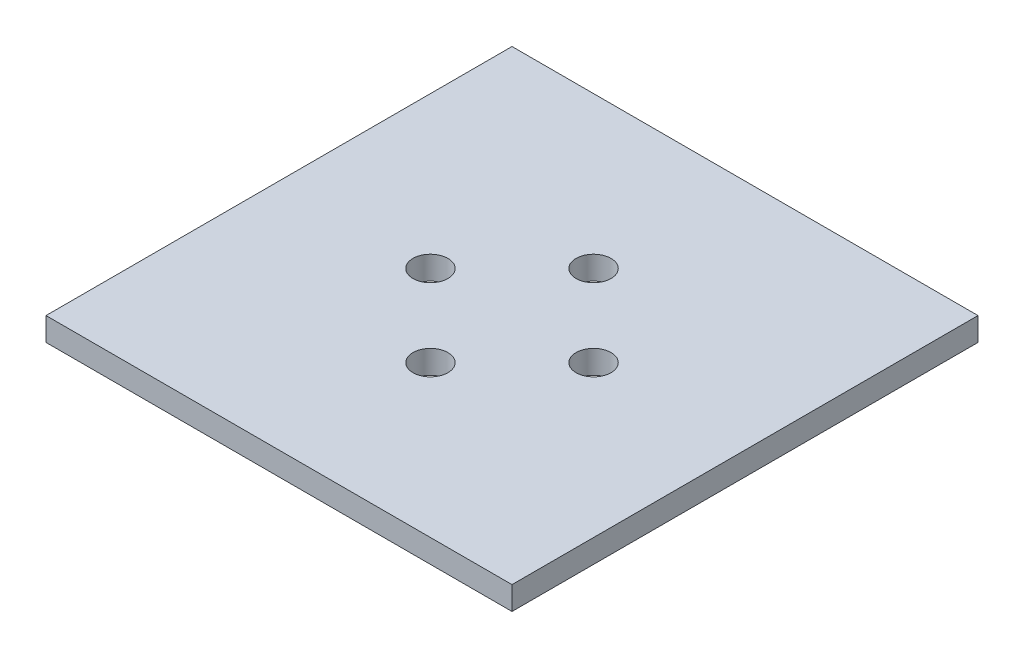
from build123d import *

# Parameters (mm, degrees)
SKETCH_1_W      = 40
SKETCH_1_H      = 40
SKETCH_1_R      = 1.5
EXTRUDE_1_DEPTH = 2


with BuildPart() as part:
    # Эскиз1 → Бобышка-Вытянуть1 (new body)
    with BuildSketch(Plane(origin=(0, 0, 0), x_dir=(1, 0, 0), z_dir=(0, 1, 0))):
        with Locations((20, 20)):
            Rectangle(SKETCH_1_W, SKETCH_1_H)
        with Locations(Location((13, 20, 0), (0, 0, 270))):
            Circle(SKETCH_1_R, mode=Mode.SUBTRACT)
        with Locations(Location((20, 27, 0), (0, 0, 270))):
            Circle(SKETCH_1_R, mode=Mode.SUBTRACT)
        with Locations(Location((27, 20, 0), (0, 0, 270))):
            Circle(SKETCH_1_R, mode=Mode.SUBTRACT)
        with Locations(Location((20, 13, 0), (0, 0, 270))):
            Circle(SKETCH_1_R, mode=Mode.SUBTRACT)
    extrude(amount=EXTRUDE_1_DEPTH)


solid = part.part
